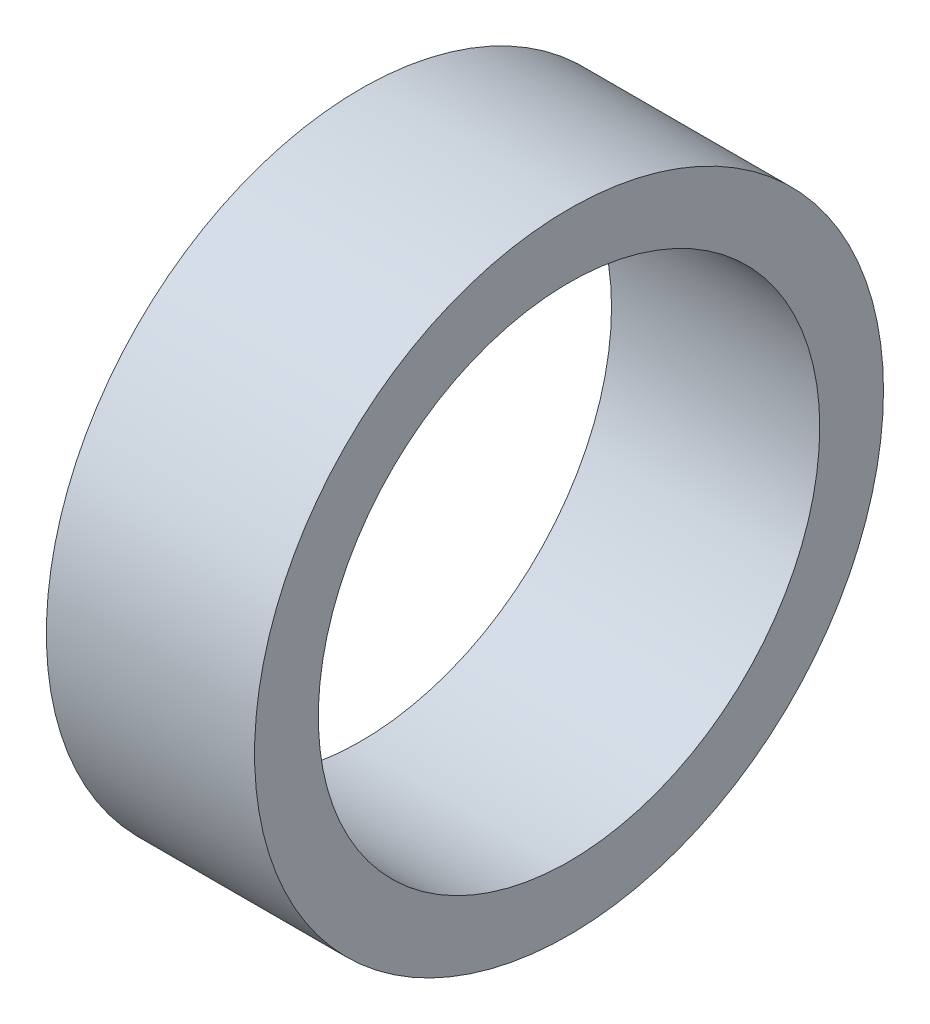
from build123d import *

# Parameters (mm, degrees)
SKETCH1_R           = 3.7592
SKETCH1_R_2         = 2.9972
BOSS_EXTRUDE1_DEPTH = 2.4892


with BuildPart() as part:
    # Sketch1 → Boss-Extrude1 (new body)
    with BuildSketch(Plane.YZ):
        with Locations(Location((0, 0, 0), (0, 0, 270))):
            Circle(SKETCH1_R)
        with Locations(Location((0, 0, 0), (0, 0, 270))):
            Circle(SKETCH1_R_2, mode=Mode.SUBTRACT)
    extrude(amount=BOSS_EXTRUDE1_DEPTH)


solid = part.part
